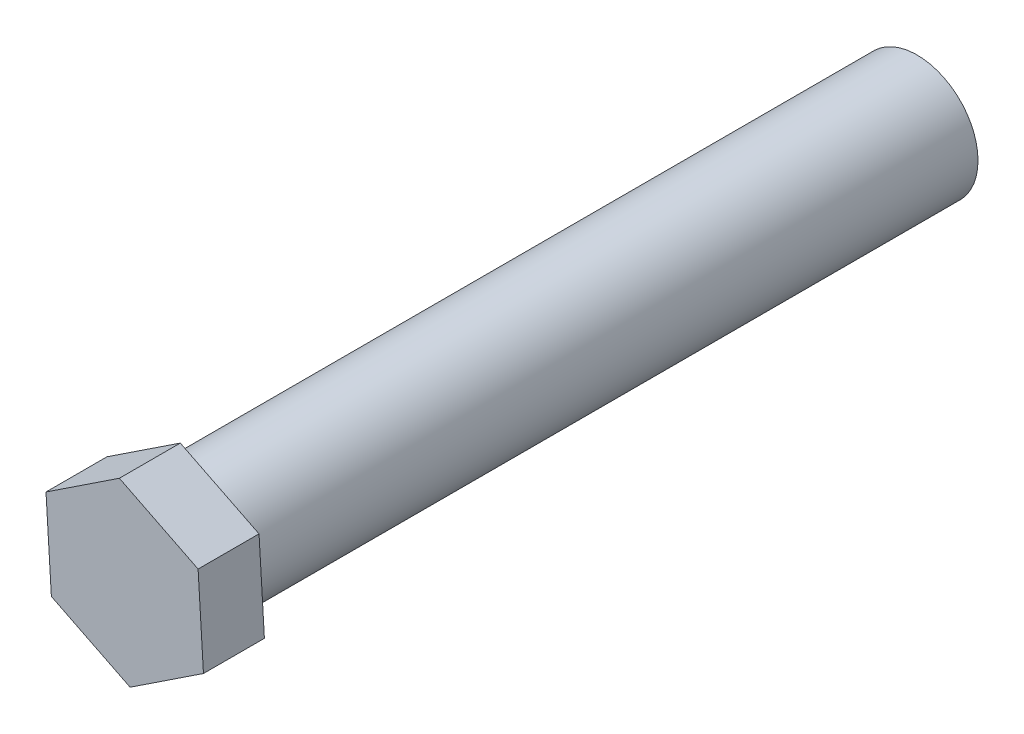
from build123d import *

# Parameters (mm, degrees)
CROQUIS1_R              = 6.35
SALIENTE_EXTRUIR1_DEPTH = 76.2
SALIENTE_EXTRUIR2_DEPTH = 6.35


with BuildPart() as part:
    # Croquis1 → Saliente-Extruir1 (new body)
    with BuildSketch(Plane.XY):
        Circle(CROQUIS1_R)
    extrude(amount=-SALIENTE_EXTRUIR1_DEPTH)

    # Croquis2 → Saliente-Extruir2 (add)
    with BuildSketch(Plane.XY):
        Polygon((8.20241726, -4.089689405), (7.642983548, 5.058657017), (-0.559433712, 9.148346422), (-8.20241726, 4.089689405), (-7.642983548, -5.058657017), (0.559433712, -9.148346422), align=None)
    extrude(amount=SALIENTE_EXTRUIR2_DEPTH)


solid = part.part
